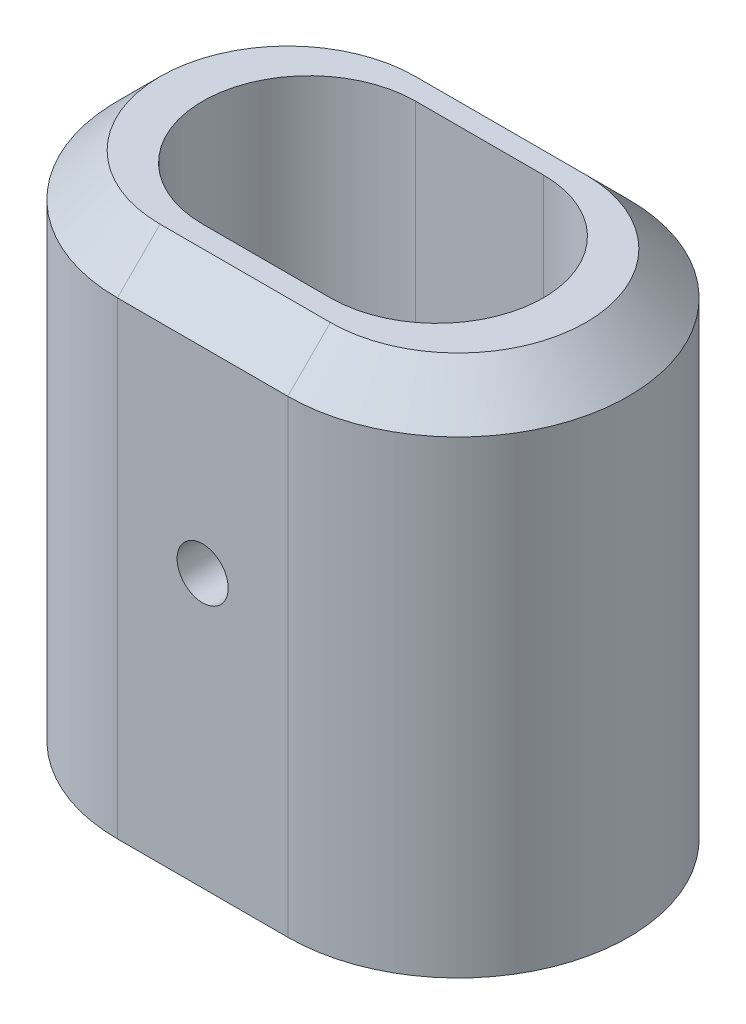
from build123d import *

# Parameters (mm, degrees)
EXTRUDE_1_DEPTH     = 60
CHAMFER_1_SIZE      = 5
CUT_EXTRUDE_1_DEPTH = 60
SKETCH_3_R          = 3
CUT_EXTRUDE_2_DEPTH = 60


with BuildPart() as part:
    # 草圖1 → 填料-伸長1 (new body)
    with BuildSketch(Plane(origin=(0, 0, 0), x_dir=(1, 0, 0), z_dir=(0, 1, 0))):
        with BuildLine():
            Line((0, 20), (20, 20))
            ThreePointArc((20, 20), (40, 0), (20, -20))
            Line((20, -20), (0, -20))
            ThreePointArc((0, -20), (-20, 0), (0, 20))
        make_face()
    extrude(amount=EXTRUDE_1_DEPTH)

    # 導角1
    chamfer_1_edges = [part.edges().sort_by_distance(p)[0] for p in [
        (40, 60, 0),
        (10, 60, -20),
        (-20, 60, 0),
        (10, 60, 20),
    ]]
    chamfer(chamfer_1_edges, length=CHAMFER_1_SIZE)

    # 草圖2 → 除料-伸長1 (cut)
    with BuildSketch(Plane(origin=(0, 60, 0), x_dir=(1, 0, 0), z_dir=(0, 1, 0))):
        with BuildLine():
            Line((2.5, 12.5), (17.5, 12.5))
            ThreePointArc((17.5, 12.5), (30, 0), (17.5, -12.5))
            Line((17.5, -12.5), (2.5, -12.5))
            ThreePointArc((2.5, -12.5), (-10, 0), (2.5, 12.5))
        make_face()
    extrude(amount=-CUT_EXTRUDE_1_DEPTH, mode=Mode.SUBTRACT)

    # 草圖3 → 除料-伸長2 (cut)
    with BuildSketch(Plane.XY.offset(20)):
        with Locations((10, 32)):
            Circle(SKETCH_3_R)
    extrude(amount=-CUT_EXTRUDE_2_DEPTH, mode=Mode.SUBTRACT)


solid = part.part
